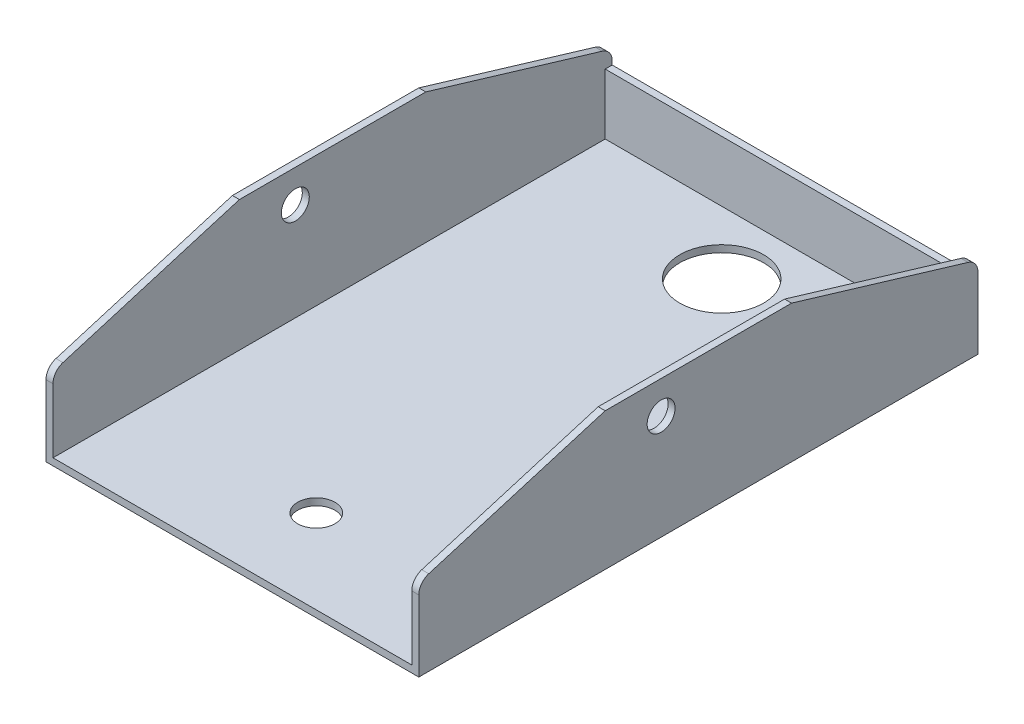
from build123d import *

# Parameters (mm, degrees)
SKETCH1_W               = 80
SKETCH1_H               = 120
SKETCH1_R               = 4
SKETCH1_R_2             = 9
BOSS_EXTRUDE1_DEPTH     = 1.5
SKETCH2_W               = 1.5
SKETCH2_H               = 120
BOSS_EXTRUDE2_DEPTH     = 28
SKETCH2_3_W             = 77
SKETCH2_3_H             = 1.5
BOSS_EXTRUDE3_DEPTH     = 13
CUT_EXTRUDE1_DEPTH      = 78.911809118
CUT_EXTRUDE1_DEPTH_BACK = 78.911809118
SKETCH3_R               = 3
FILLET1_R               = 3


with BuildPart() as part:
    # Sketch1 → Boss-Extrude1 (new body)
    with BuildSketch(Plane(origin=(0, 0, 0), x_dir=(1, 0, 0), z_dir=(0, 1, 0))):
        Rectangle(SKETCH1_W, SKETCH1_H)
        with Locations((0, -42)):
            Circle(SKETCH1_R, mode=Mode.SUBTRACT)
        with Locations((0, 45)):
            Circle(SKETCH1_R_2, mode=Mode.SUBTRACT)
    extrude(amount=BOSS_EXTRUDE1_DEPTH)

    # Sketch2 → Boss-Extrude2 (add)
    with BuildSketch(Plane(origin=(0, 1.5, 0), x_dir=(1, 0, 0), z_dir=(0, 1, 0))):
        with Locations((-39.25, 0)):
            Rectangle(SKETCH2_W, SKETCH2_H)
        with Locations((39.25, 0)):
            Rectangle(SKETCH2_W, SKETCH2_H)
    extrude(amount=BOSS_EXTRUDE2_DEPTH)

    # Sketch2<3> → Boss-Extrude3 (add)
    with BuildSketch(Plane(origin=(0, 1.5, 0), x_dir=(1, 0, 0), z_dir=(0, 1, 0))):
        with Locations((0, 59.25)):
            Rectangle(SKETCH2_3_W, SKETCH2_3_H)
    extrude(amount=BOSS_EXTRUDE3_DEPTH)

    # Sketch3 → Cut-Extrude1 (cut, two sides: drawn at the far end of the back side and taken through both)
    with BuildSketch(Plane(origin=(0, 0, 0), x_dir=(0, 0, -1), z_dir=(1, 0, 0)).offset(-CUT_EXTRUDE1_DEPTH_BACK)):
        with Locations((-8, 22.5)):
            Circle(SKETCH3_R)
        Polygon((20, 29.5), (60, 29.5), (60, 17.5), align=None)
        Polygon((-60, 17.5), (-20, 29.5), (-60, 29.5), align=None)
    extrude(amount=CUT_EXTRUDE1_DEPTH + CUT_EXTRUDE1_DEPTH_BACK, mode=Mode.SUBTRACT)

    # Fillet1
    fillet1_edges = [part.edges().sort_by_distance(p)[0] for p in [
        (39.25, 17.5, 60),
        (-39.25, 17.5, 60),
        (-39.25, 17.5, -60),
        (39.25, 17.5, -60),
    ]]
    fillet(fillet1_edges, radius=FILLET1_R)


solid = part.part
